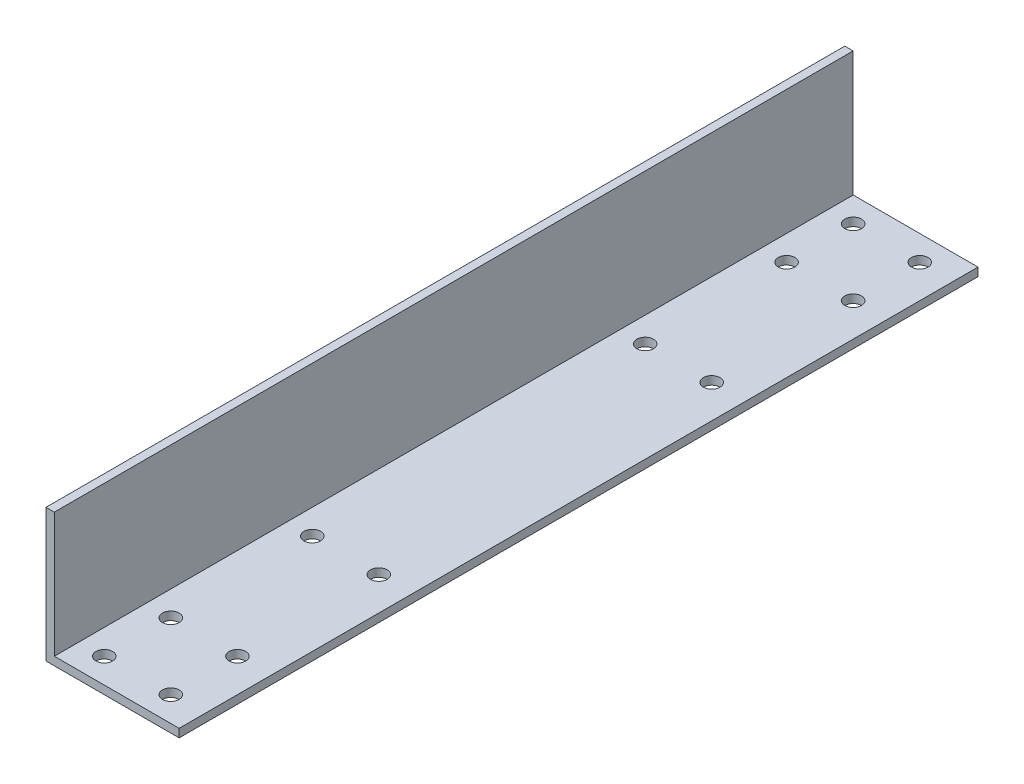
from build123d import *

# Parameters (mm, degrees)
BOSS_EXTRUDE1_DEPTH = 304.8
SKETCH2_R           = 3.175
CUT_EXTRUDE1_DEPTH  = 314.152231351


with BuildPart() as part:
    # Sketch1 → Boss-Extrude1 (new body)
    with BuildSketch(Plane.XY):
        Polygon((0, 0), (50.8, 0), (50.8, 3.175), (3.175, 3.175), (3.175, 50.8), (0, 50.8), align=None)
    extrude(amount=BOSS_EXTRUDE1_DEPTH)

    # Sketch2 → Cut-Extrude1 (cut, through all)
    with BuildSketch(Plane.XZ):
        with Locations(Location((12.7, 9.525, 0), (0, 0, 270))):
            Circle(SKETCH2_R)
        with Locations(Location((12.7, 34.925, 0), (0, 0, 270))):
            Circle(SKETCH2_R)
        with Locations(Location((38.1, 34.925, 0), (0, 0, 270))):
            Circle(SKETCH2_R)
        with Locations(Location((38.1, 9.525, 0), (0, 0, 270))):
            Circle(SKETCH2_R)
        with Locations(Location((12.7, 215.9, 0), (0, 0, 270))):
            Circle(SKETCH2_R)
        with Locations(Location((38.1, 215.9, 0), (0, 0, 270))):
            Circle(SKETCH2_R)
        with Locations(Location((38.1, 88.9, 0), (0, 0, 270))):
            Circle(SKETCH2_R)
        with Locations(Location((12.7, 88.9, 0), (0, 0, 270))):
            Circle(SKETCH2_R)
        with Locations(Location((12.7, 295.275, 0), (0, 0, 270))):
            Circle(SKETCH2_R)
        with Locations(Location((12.7, 269.875, 0), (0, 0, 270))):
            Circle(SKETCH2_R)
        with Locations(Location((38.1, 269.875, 0), (0, 0, 270))):
            Circle(SKETCH2_R)
        with Locations(Location((38.1, 295.275, 0), (0, 0, 270))):
            Circle(SKETCH2_R)
    extrude(amount=-CUT_EXTRUDE1_DEPTH, mode=Mode.SUBTRACT)


solid = part.part
